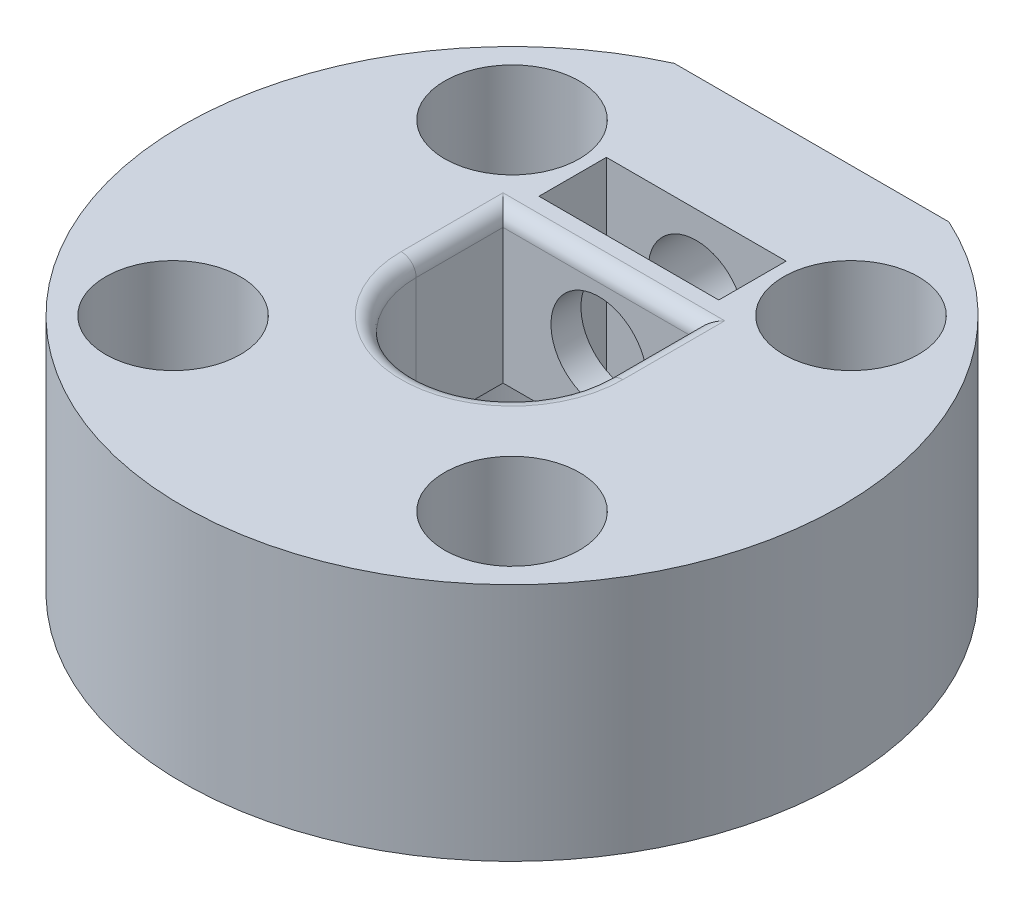
from build123d import *

# Parameters (mm, degrees)
BOSS_EXTRU_1_DEPTH                              = 8
CHAMBRAGE_POUR_VIS_T_TE_CYLINDRIQUE_D           = 2.5
CHAMBRAGE_POUR_VIS_T_TE_CYLINDRIQUE_CBORE_D     = 4.5
CHAMBRAGE_POUR_VIS_T_TE_CYLINDRIQUE_CBORE_DEPTH = 6.5
CONG_1_R                                        = 0.5
ESQUISSE6_R                                     = 1.6
ENL_V_MAT_EXTRU_1_DEPTH                         = 18.49285573
ESQUISSE7_W                                     = 6
ESQUISSE7_H                                     = 2.25
ENL_V_MAT_EXTRU_2_DEPTH                         = 18.492855685
ESQUISSE8_R                                     = 5.5
ENL_V_MAT_EXTRU_3_DEPTH                         = 3


with BuildPart() as part:
    # Esquisse1 → Boss.-Extru.1 (new body)
    with BuildSketch(Plane(origin=(0, 0, 0), x_dir=(1, 0, 0), z_dir=(0, 1, 0))):
        with BuildLine():
            Line((4.582575695, 10), (-4.582575695, 10))
            ThreePointArc((-4.582575695, 10), (0, -11), (4.582575695, 10))
        make_face()
        with BuildLine():
            Line((-3.2, 0), (-3.2, 2.9))
            Line((-3.2, 2.9), (3.2, 2.9))
            Line((3.2, 2.9), (3.2, 0))
            ThreePointArc((3.2, 0), (0, -3.2), (-3.2, 0))
        make_face(mode=Mode.SUBTRACT)
    extrude(amount=BOSS_EXTRU_1_DEPTH)

    # Chambrage pour vis à tête cylindrique à 6 pans creux (ou vis CHC) M21 (through all)
    with Locations(Plane(origin=(0, 8, 0), x_dir=(1, 0, 0), z_dir=(0, 1, 0))):
        with Locations((5.656854249, 5.656854249), (5.656854249, -5.656854249), (-5.656854249, -5.656854249), (-5.656854249, 5.656854249), (0, 0)):
            CounterBoreHole(CHAMBRAGE_POUR_VIS_T_TE_CYLINDRIQUE_D / 2, CHAMBRAGE_POUR_VIS_T_TE_CYLINDRIQUE_CBORE_D / 2, CHAMBRAGE_POUR_VIS_T_TE_CYLINDRIQUE_CBORE_DEPTH)

    # Congé1
    cong_1_edges = [part.edges().sort_by_distance(p)[0] for p in [
        (0, 8, 3.2),
        (3.2, 8, -1.45),
        (0, 8, -2.9),
        (-3.2, 8, -1.45),
    ]]
    fillet(cong_1_edges, radius=CONG_1_R)

    # Esquisse6 → Enlèv. mat.-Extru.1 (cut, through all)
    with BuildSketch(Plane.XY):
        with Locations((0, 5.5)):
            Circle(ESQUISSE6_R)
    extrude(amount=-ENL_V_MAT_EXTRU_1_DEPTH, mode=Mode.SUBTRACT)

    # Esquisse7 → Enlèv. mat.-Extru.2 (cut, through all)
    with BuildSketch(Plane(origin=(0, 8, 0), x_dir=(1, 0, 0), z_dir=(0, 1, 0))):
        with Locations((0, 5.025)):
            Rectangle(ESQUISSE7_W, ESQUISSE7_H)
    extrude(amount=-ENL_V_MAT_EXTRU_2_DEPTH, mode=Mode.SUBTRACT)

    # Esquisse8 → Enlèv. mat.-Extru.3 (cut)
    with BuildSketch(Plane(origin=(0, 0, 0), x_dir=(-1, 0, 0), z_dir=(0, -1, 0))):
        Circle(ESQUISSE8_R)
    extrude(amount=-ENL_V_MAT_EXTRU_3_DEPTH, mode=Mode.SUBTRACT)


solid = part.part
